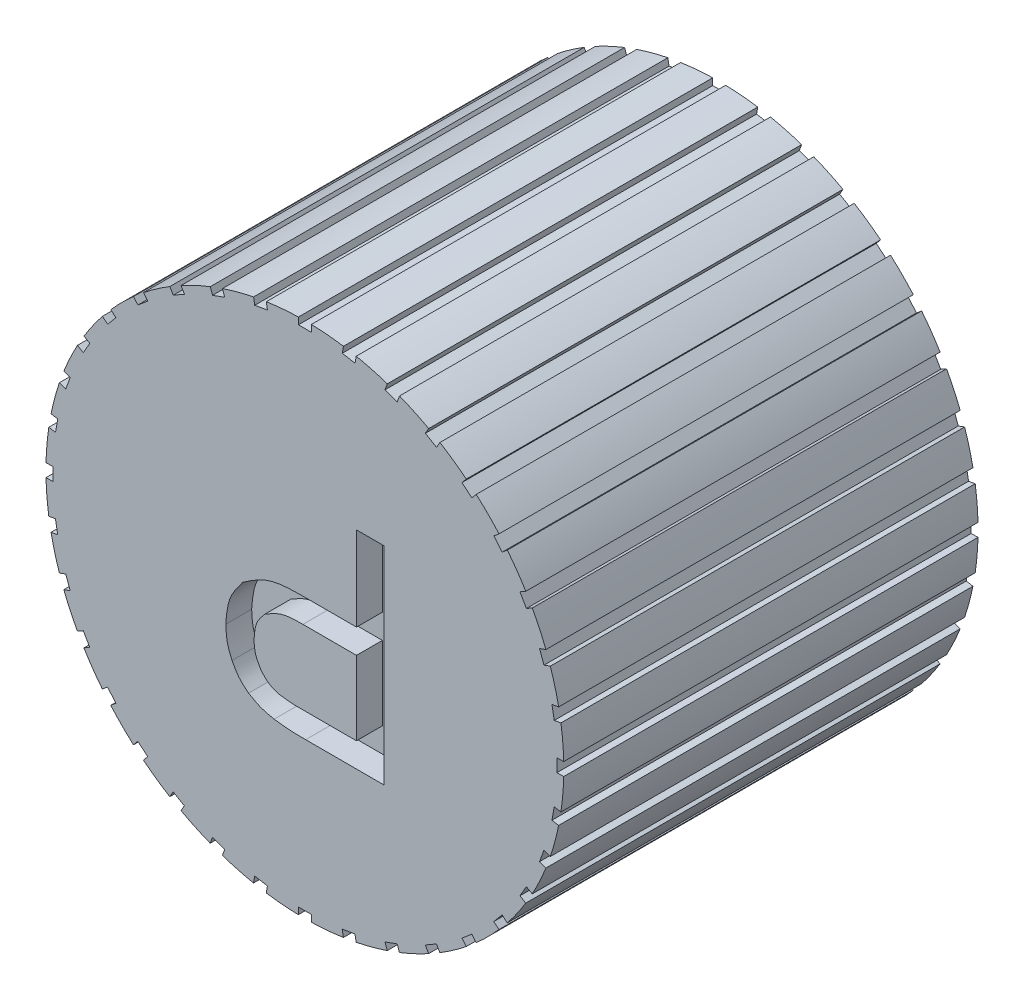
from build123d import *

# Parameters (mm, degrees)
SKETCH1_W                    = 10.000000149
SKETCH1_H                    = 16
CUT_EXTRUDE1_DEPTH           = 16
CUT_EXTRUDE2_DEPTH           = 16
CUT_EXTRUDE3_DEPTH           = 16
CUT_EXTRUDE4_DEPTH           = 16
CUT_EXTRUDE5_DEPTH           = 16
CUT_EXTRUDE6_DEPTH           = 16
CUT_EXTRUDE7_DEPTH           = 16
CUT_EXTRUDE8_DEPTH           = 16
CUT_EXTRUDE9_DEPTH           = 16
CUT_EXTRUDE10_DEPTH          = 16
CUT_EXTRUDE11_DEPTH          = 16
CUT_EXTRUDE12_DEPTH          = 16
CUT_EXTRUDE13_DEPTH          = 16
CUT_EXTRUDE14_DEPTH          = 16
CUT_EXTRUDE15_DEPTH          = 16
CUT_EXTRUDE16_DEPTH          = 16
CUT_EXTRUDE17_DEPTH          = 16
CUT_EXTRUDE18_DEPTH          = 16
CUT_EXTRUDE19_DEPTH          = 16
CUT_EXTRUDE20_DEPTH          = 16
CUT_EXTRUDE21_DEPTH          = 16
CUT_EXTRUDE22_DEPTH          = 16
CUT_EXTRUDE23_DEPTH          = 16
CUT_EXTRUDE24_DEPTH          = 16
CUT_EXTRUDE25_DEPTH          = 16
CUT_EXTRUDE26_DEPTH          = 16
CUT_EXTRUDE27_DEPTH          = 16
CUT_EXTRUDE28_DEPTH          = 16
CUT_EXTRUDE29_DEPTH          = 16
CUT_EXTRUDE30_DEPTH          = 16
CUT_EXTRUDE31_DEPTH          = 16
CUT_EXTRUDE32_DEPTH          = 16
CUT_EXTRUDE33_DEPTH          = 16
CUT_EXTRUDE34_DEPTH          = 16
CUT_EXTRUDE35_DEPTH          = 16
CUT_EXTRUDE36_DEPTH          = 16
CUT_EXTRUDE37_START          = 3
CUT_EXTRUDE37_DEPTH          = 1
BOSS_EXTRUDE1_START          = 2.999997
BOSS_EXTRUDE1_DEPTH          = 1
F_6_0_6_DIAMETER_HOLE1_D     = 6
F_6_0_6_DIAMETER_HOLE1_DEPTH = 14


with BuildPart() as part:
    # Sketch1 → Revolve1 (revolve)
    with BuildSketch(Plane(origin=(0, 0, 0), x_dir=(1, 0, 0), z_dir=(0, 1, 0))):
        with Locations((5.000000074, -8)):
            Rectangle(SKETCH1_W, SKETCH1_H)
    revolve(axis=Axis((0, 0, 0), (0, 0, 1)))

    # Sketch2 → Cut-Extrude1 (cut)
    with BuildSketch(Plane(origin=(0, 0, 0), x_dir=(-1, 0, 0), z_dir=(0, 0, -1))):
        with BuildLine():
            Line((3.182999705, 9.479900625), (3.093633551, 9.234369134))
            Line((3.093633551, 9.234369134), (3.563197034, 9.063462003))
            Line((3.563197034, 9.063462003), (3.65258757, 9.30906048))
            ThreePointArc((3.65258757, 9.30906048), (3.418860912, 9.397414168), (3.182999705, 9.479900625))
        make_face()
    extrude(amount=-CUT_EXTRUDE1_DEPTH, mode=Mode.SUBTRACT)

    # Sketch3 → Cut-Extrude2 (cut)
    with BuildSketch(Plane(origin=(0, 0, 0), x_dir=(-1, 0, 0), z_dir=(0, 0, -1))):
        with BuildLine():
            Line((4.780810256, 8.783157535), (4.650165678, 8.556874488))
            Line((4.650165678, 8.556874488), (5.082917725, 8.307024978))
            Line((5.082917725, 8.307024978), (5.213597945, 8.533369759))
            ThreePointArc((5.213597945, 8.533369759), (4.998764578, 8.660967364), (4.780810256, 8.783157535))
        make_face()
    extrude(amount=-CUT_EXTRUDE2_DEPTH, mode=Mode.SUBTRACT)

    # Sketch4 → Cut-Extrude3 (cut)
    with BuildSketch(Plane(origin=(0, 0, 0), x_dir=(-1, 0, 0), z_dir=(0, 0, -1))):
        with BuildLine():
            Line((6.233358306, 7.819542647), (6.065404874, 7.619383542))
            Line((6.065404874, 7.619383542), (6.448196533, 7.298183202))
            Line((6.448196533, 7.298183202), (6.616195786, 7.498396916))
            ThreePointArc((6.616195786, 7.498396916), (6.426783311, 7.661361449), (6.233358306, 7.819542647))
        make_face()
    extrude(amount=-CUT_EXTRUDE3_DEPTH, mode=Mode.SUBTRACT)

    # Sketch5 → Cut-Extrude4 (cut)
    with BuildSketch(Plane(origin=(0, 0, 0), x_dir=(-1, 0, 0), z_dir=(0, 0, -1))):
        with BuildLine():
            Line((7.496508918, 6.618334914), (7.296349812, 6.450381482))
            Line((7.296349812, 6.450381482), (7.617550152, 6.067589824))
            Line((7.617550152, 6.067589824), (7.817763865, 6.235589077))
            ThreePointArc((7.817763865, 6.235589077), (7.659527486, 6.428968943), (7.496508918, 6.618334914))
        make_face()
    extrude(amount=-CUT_EXTRUDE4_DEPTH, mode=Mode.SUBTRACT)

    # Sketch6 → Cut-Extrude5 (cut)
    with BuildSketch(Plane(origin=(0, 0, 0), x_dir=(-1, 0, 0), z_dir=(0, 0, -1))):
        with BuildLine():
            Line((8.531881899, 5.216032423), (8.305598853, 5.085387845))
            Line((8.305598853, 5.085387845), (8.555448364, 4.652635798))
            Line((8.555448364, 4.652635798), (8.781793145, 4.783316019))
            ThreePointArc((8.781793145, 4.783316019), (8.659540794, 5.001235469), (8.531881899, 5.216032423))
        make_face()
    extrude(amount=-CUT_EXTRUDE5_DEPTH, mode=Mode.SUBTRACT)

    # Sketch7 → Cut-Extrude6 (cut)
    with BuildSketch(Plane(origin=(0, 0, 0), x_dir=(-1, 0, 0), z_dir=(0, 0, -1))):
        with BuildLine():
            Line((9.308017967, 3.655243426), (9.062486476, 3.565877272))
            Line((9.062486476, 3.565877272), (9.233393607, 3.096313789))
            Line((9.233393607, 3.096313789), (9.478992085, 3.185704324))
            ThreePointArc((9.478992085, 3.185704324), (9.396438337, 3.421541987), (9.308017967, 3.655243426))
        make_face()
    extrude(amount=-CUT_EXTRUDE6_DEPTH, mode=Mode.SUBTRACT)

    # Sketch8 → Cut-Extrude7 (cut)
    with BuildSketch(Plane(origin=(0, 0, 0), x_dir=(-1, 0, 0), z_dir=(0, 0, -1))):
        with BuildLine():
            Line((9.801334619, 1.983391707), (9.544015033, 1.938019322))
            Line((9.544015033, 1.938019322), (9.630786858, 1.445911851))
            Line((9.630786858, 1.445911851), (9.888176646, 1.491296615))
            ThreePointArc((9.888176646, 1.491296615), (9.847829855, 1.737886682), (9.801334619, 1.983391707))
        make_face()
    extrude(amount=-CUT_EXTRUDE7_DEPTH, mode=Mode.SUBTRACT)

    # Sketch9 → Cut-Extrude8 (cut)
    with BuildSketch(Plane(origin=(0, 0, 0), x_dir=(-1, 0, 0), z_dir=(0, 0, -1))):
        with BuildLine():
            Line((9.996842678, 0.251275635), (9.735553523, 0.251275635))
            Line((9.735553523, 0.251275635), (9.735553523, -0.248423386))
            Line((9.735553523, -0.248423386), (9.996913964, -0.248423386))
            ThreePointArc((9.996913964, -0.248423386), (10.000000047, 0.00142657), (9.996842678, 0.251275635))
        make_face()
    extrude(amount=-CUT_EXTRUDE8_DEPTH, mode=Mode.SUBTRACT)

    # Sketch10 → Cut-Extrude9 (cut)
    with BuildSketch(Plane(origin=(0, 0, 0), x_dir=(-1, 0, 0), z_dir=(0, 0, -1))):
        with BuildLine():
            Line((9.888601731, -1.48847532), (9.631282146, -1.443102934))
            Line((9.631282146, -1.443102934), (9.544510321, -1.935210405))
            Line((9.544510321, -1.935210405), (9.80190011, -1.980595169))
            ThreePointArc((9.80190011, -1.980595169), (9.848325298, -1.735076888), (9.888601731, -1.48847532))
        make_face()
    extrude(amount=-CUT_EXTRUDE9_DEPTH, mode=Mode.SUBTRACT)

    # Sketch11 → Cut-Extrude10 (cut)
    with BuildSketch(Plane(origin=(0, 0, 0), x_dir=(-1, 0, 0), z_dir=(0, 0, -1))):
        with BuildLine():
            Line((9.479900625, -3.182999705), (9.234369134, -3.093633551))
            Line((9.234369134, -3.093633551), (9.063462003, -3.563197034))
            Line((9.063462003, -3.563197034), (9.30906048, -3.65258757))
            ThreePointArc((9.30906048, -3.65258757), (9.397414168, -3.418860912), (9.479900625, -3.182999705))
        make_face()
    extrude(amount=-CUT_EXTRUDE10_DEPTH, mode=Mode.SUBTRACT)

    # Sketch12 → Cut-Extrude11 (cut)
    with BuildSketch(Plane(origin=(0, 0, 0), x_dir=(-1, 0, 0), z_dir=(0, 0, -1))):
        with BuildLine():
            Line((8.783157535, -4.780810256), (8.556874488, -4.650165678))
            Line((8.556874488, -4.650165678), (8.307024978, -5.082917725))
            Line((8.307024978, -5.082917725), (8.533369759, -5.213597945))
            ThreePointArc((8.533369759, -5.213597945), (8.660967364, -4.998764578), (8.783157535, -4.780810256))
        make_face()
    extrude(amount=-CUT_EXTRUDE11_DEPTH, mode=Mode.SUBTRACT)

    # Sketch13 → Cut-Extrude12 (cut)
    with BuildSketch(Plane(origin=(0, 0, 0), x_dir=(-1, 0, 0), z_dir=(0, 0, -1))):
        with BuildLine():
            Line((7.819542647, -6.233358306), (7.619383542, -6.065404874))
            Line((7.619383542, -6.065404874), (7.298183202, -6.448196533))
            Line((7.298183202, -6.448196533), (7.498396916, -6.616195786))
            ThreePointArc((7.498396916, -6.616195786), (7.661361449, -6.426783311), (7.819542647, -6.233358306))
        make_face()
    extrude(amount=-CUT_EXTRUDE12_DEPTH, mode=Mode.SUBTRACT)

    # Sketch14 → Cut-Extrude13 (cut)
    with BuildSketch(Plane(origin=(0, 0, 0), x_dir=(-1, 0, 0), z_dir=(0, 0, -1))):
        with BuildLine():
            Line((6.618334914, -7.496508918), (6.450381482, -7.296349812))
            Line((6.450381482, -7.296349812), (6.067589824, -7.617550152))
            Line((6.067589824, -7.617550152), (6.235589077, -7.817763865))
            ThreePointArc((6.235589077, -7.817763865), (6.428968943, -7.659527486), (6.618334914, -7.496508918))
        make_face()
    extrude(amount=-CUT_EXTRUDE13_DEPTH, mode=Mode.SUBTRACT)

    # Sketch15 → Cut-Extrude14 (cut)
    with BuildSketch(Plane(origin=(0, 0, 0), x_dir=(-1, 0, 0), z_dir=(0, 0, -1))):
        with BuildLine():
            Line((5.216032423, -8.531881899), (5.085387845, -8.305598853))
            Line((5.085387845, -8.305598853), (4.652635798, -8.555448364))
            Line((4.652635798, -8.555448364), (4.783316019, -8.781793145))
            ThreePointArc((4.783316019, -8.781793145), (5.001235469, -8.659540794), (5.216032423, -8.531881899))
        make_face()
    extrude(amount=-CUT_EXTRUDE14_DEPTH, mode=Mode.SUBTRACT)

    # Sketch16 → Cut-Extrude15 (cut)
    with BuildSketch(Plane(origin=(0, 0, 0), x_dir=(-1, 0, 0), z_dir=(0, 0, -1))):
        with BuildLine():
            Line((3.655243426, -9.308017967), (3.565877272, -9.062486476))
            Line((3.565877272, -9.062486476), (3.096313789, -9.233393607))
            Line((3.096313789, -9.233393607), (3.185704324, -9.478992085))
            ThreePointArc((3.185704324, -9.478992085), (3.421541987, -9.396438337), (3.655243426, -9.308017967))
        make_face()
    extrude(amount=-CUT_EXTRUDE15_DEPTH, mode=Mode.SUBTRACT)

    # Sketch17 → Cut-Extrude16 (cut)
    with BuildSketch(Plane(origin=(0, 0, 0), x_dir=(-1, 0, 0), z_dir=(0, 0, -1))):
        with BuildLine():
            Line((1.983391707, -9.801334619), (1.938019322, -9.544015033))
            Line((1.938019322, -9.544015033), (1.445911851, -9.630786858))
            Line((1.445911851, -9.630786858), (1.491296615, -9.888176646))
            ThreePointArc((1.491296615, -9.888176646), (1.737886682, -9.847829855), (1.983391707, -9.801334619))
        make_face()
    extrude(amount=-CUT_EXTRUDE16_DEPTH, mode=Mode.SUBTRACT)

    # Sketch18 → Cut-Extrude17 (cut)
    with BuildSketch(Plane(origin=(0, 0, 0), x_dir=(-1, 0, 0), z_dir=(0, 0, -1))):
        with BuildLine():
            Line((0.251275635, -9.996842678), (0.251275635, -9.735553523))
            Line((0.251275635, -9.735553523), (-0.248423386, -9.735553523))
            Line((-0.248423386, -9.735553523), (-0.248423386, -9.996913964))
            ThreePointArc((-0.248423386, -9.996913964), (0.00142657, -10.000000047), (0.251275635, -9.996842678))
        make_face()
    extrude(amount=-CUT_EXTRUDE17_DEPTH, mode=Mode.SUBTRACT)

    # Sketch19 → Cut-Extrude18 (cut)
    with BuildSketch(Plane(origin=(0, 0, 0), x_dir=(-1, 0, 0), z_dir=(0, 0, -1))):
        with BuildLine():
            Line((-1.48847532, -9.888601731), (-1.443102934, -9.631282146))
            Line((-1.443102934, -9.631282146), (-1.935210405, -9.544510321))
            Line((-1.935210405, -9.544510321), (-1.980595169, -9.80190011))
            ThreePointArc((-1.980595169, -9.80190011), (-1.735076888, -9.848325298), (-1.48847532, -9.888601731))
        make_face()
    extrude(amount=-CUT_EXTRUDE18_DEPTH, mode=Mode.SUBTRACT)

    # Sketch20 → Cut-Extrude19 (cut)
    with BuildSketch(Plane(origin=(0, 0, 0), x_dir=(-1, 0, 0), z_dir=(0, 0, -1))):
        with BuildLine():
            Line((-3.182999705, -9.479900625), (-3.093633551, -9.234369134))
            Line((-3.093633551, -9.234369134), (-3.563197034, -9.063462003))
            Line((-3.563197034, -9.063462003), (-3.65258757, -9.30906048))
            ThreePointArc((-3.65258757, -9.30906048), (-3.418860912, -9.397414168), (-3.182999705, -9.479900625))
        make_face()
    extrude(amount=-CUT_EXTRUDE19_DEPTH, mode=Mode.SUBTRACT)

    # Sketch21 → Cut-Extrude20 (cut)
    with BuildSketch(Plane(origin=(0, 0, 0), x_dir=(-1, 0, 0), z_dir=(0, 0, -1))):
        with BuildLine():
            Line((-4.780810256, -8.783157535), (-4.650165678, -8.556874488))
            Line((-4.650165678, -8.556874488), (-5.082917725, -8.307024978))
            Line((-5.082917725, -8.307024978), (-5.213597945, -8.533369759))
            ThreePointArc((-5.213597945, -8.533369759), (-4.998764578, -8.660967364), (-4.780810256, -8.783157535))
        make_face()
    extrude(amount=-CUT_EXTRUDE20_DEPTH, mode=Mode.SUBTRACT)

    # Sketch22 → Cut-Extrude21 (cut)
    with BuildSketch(Plane(origin=(0, 0, 0), x_dir=(-1, 0, 0), z_dir=(0, 0, -1))):
        with BuildLine():
            Line((-6.233358306, -7.819542647), (-6.065404874, -7.619383542))
            Line((-6.065404874, -7.619383542), (-6.448196533, -7.298183202))
            Line((-6.448196533, -7.298183202), (-6.616195786, -7.498396916))
            ThreePointArc((-6.616195786, -7.498396916), (-6.426783311, -7.661361449), (-6.233358306, -7.819542647))
        make_face()
    extrude(amount=-CUT_EXTRUDE21_DEPTH, mode=Mode.SUBTRACT)

    # Sketch23 → Cut-Extrude22 (cut)
    with BuildSketch(Plane(origin=(0, 0, 0), x_dir=(-1, 0, 0), z_dir=(0, 0, -1))):
        with BuildLine():
            Line((-7.496508918, -6.618334914), (-7.296349812, -6.450381482))
            Line((-7.296349812, -6.450381482), (-7.617550152, -6.067589824))
            Line((-7.617550152, -6.067589824), (-7.817763865, -6.235589077))
            ThreePointArc((-7.817763865, -6.235589077), (-7.659527486, -6.428968943), (-7.496508918, -6.618334914))
        make_face()
    extrude(amount=-CUT_EXTRUDE22_DEPTH, mode=Mode.SUBTRACT)

    # Sketch24 → Cut-Extrude23 (cut)
    with BuildSketch(Plane(origin=(0, 0, 0), x_dir=(-1, 0, 0), z_dir=(0, 0, -1))):
        with BuildLine():
            Line((-8.531881899, -5.216032423), (-8.305598853, -5.085387845))
            Line((-8.305598853, -5.085387845), (-8.555448364, -4.652635798))
            Line((-8.555448364, -4.652635798), (-8.781793145, -4.783316019))
            ThreePointArc((-8.781793145, -4.783316019), (-8.659540794, -5.001235469), (-8.531881899, -5.216032423))
        make_face()
    extrude(amount=-CUT_EXTRUDE23_DEPTH, mode=Mode.SUBTRACT)

    # Sketch25 → Cut-Extrude24 (cut)
    with BuildSketch(Plane(origin=(0, 0, 0), x_dir=(-1, 0, 0), z_dir=(0, 0, -1))):
        with BuildLine():
            Line((-9.308017967, -3.655243426), (-9.062486476, -3.565877272))
            Line((-9.062486476, -3.565877272), (-9.233393607, -3.096313789))
            Line((-9.233393607, -3.096313789), (-9.478992085, -3.185704324))
            ThreePointArc((-9.478992085, -3.185704324), (-9.396438337, -3.421541987), (-9.308017967, -3.655243426))
        make_face()
    extrude(amount=-CUT_EXTRUDE24_DEPTH, mode=Mode.SUBTRACT)

    # Sketch26 → Cut-Extrude25 (cut)
    with BuildSketch(Plane(origin=(0, 0, 0), x_dir=(-1, 0, 0), z_dir=(0, 0, -1))):
        with BuildLine():
            Line((-9.801334619, -1.983391707), (-9.544015033, -1.938019322))
            Line((-9.544015033, -1.938019322), (-9.630786858, -1.445911851))
            Line((-9.630786858, -1.445911851), (-9.888176646, -1.491296615))
            ThreePointArc((-9.888176646, -1.491296615), (-9.847829855, -1.737886682), (-9.801334619, -1.983391707))
        make_face()
    extrude(amount=-CUT_EXTRUDE25_DEPTH, mode=Mode.SUBTRACT)

    # Sketch27 → Cut-Extrude26 (cut)
    with BuildSketch(Plane(origin=(0, 0, 0), x_dir=(-1, 0, 0), z_dir=(0, 0, -1))):
        with BuildLine():
            Line((-9.996842678, -0.251275635), (-9.735553523, -0.251275635))
            Line((-9.735553523, -0.251275635), (-9.735553523, 0.248423386))
            Line((-9.735553523, 0.248423386), (-9.996913964, 0.248423386))
            ThreePointArc((-9.996913964, 0.248423386), (-10.000000047, -0.00142657), (-9.996842678, -0.251275635))
        make_face()
    extrude(amount=-CUT_EXTRUDE26_DEPTH, mode=Mode.SUBTRACT)

    # Sketch28 → Cut-Extrude27 (cut)
    with BuildSketch(Plane(origin=(0, 0, 0), x_dir=(-1, 0, 0), z_dir=(0, 0, -1))):
        with BuildLine():
            Line((-9.888601731, 1.48847532), (-9.631282146, 1.443102934))
            Line((-9.631282146, 1.443102934), (-9.544510321, 1.935210405))
            Line((-9.544510321, 1.935210405), (-9.80190011, 1.980595169))
            ThreePointArc((-9.80190011, 1.980595169), (-9.848325298, 1.735076888), (-9.888601731, 1.48847532))
        make_face()
    extrude(amount=-CUT_EXTRUDE27_DEPTH, mode=Mode.SUBTRACT)

    # Sketch29 → Cut-Extrude28 (cut)
    with BuildSketch(Plane(origin=(0, 0, 0), x_dir=(-1, 0, 0), z_dir=(0, 0, -1))):
        with BuildLine():
            Line((-9.479900625, 3.182999705), (-9.234369134, 3.093633551))
            Line((-9.234369134, 3.093633551), (-9.063462003, 3.563197034))
            Line((-9.063462003, 3.563197034), (-9.30906048, 3.65258757))
            ThreePointArc((-9.30906048, 3.65258757), (-9.397414168, 3.418860912), (-9.479900625, 3.182999705))
        make_face()
    extrude(amount=-CUT_EXTRUDE28_DEPTH, mode=Mode.SUBTRACT)

    # Sketch30 → Cut-Extrude29 (cut)
    with BuildSketch(Plane(origin=(0, 0, 0), x_dir=(-1, 0, 0), z_dir=(0, 0, -1))):
        with BuildLine():
            Line((-8.783157535, 4.780810256), (-8.556874488, 4.650165678))
            Line((-8.556874488, 4.650165678), (-8.307024978, 5.082917725))
            Line((-8.307024978, 5.082917725), (-8.533369759, 5.213597945))
            ThreePointArc((-8.533369759, 5.213597945), (-8.660967364, 4.998764578), (-8.783157535, 4.780810256))
        make_face()
    extrude(amount=-CUT_EXTRUDE29_DEPTH, mode=Mode.SUBTRACT)

    # Sketch31 → Cut-Extrude30 (cut)
    with BuildSketch(Plane(origin=(0, 0, 0), x_dir=(-1, 0, 0), z_dir=(0, 0, -1))):
        with BuildLine():
            Line((-7.819542647, 6.233358306), (-7.619383542, 6.065404874))
            Line((-7.619383542, 6.065404874), (-7.298183202, 6.448196533))
            Line((-7.298183202, 6.448196533), (-7.498396916, 6.616195786))
            ThreePointArc((-7.498396916, 6.616195786), (-7.661361449, 6.426783311), (-7.819542647, 6.233358306))
        make_face()
    extrude(amount=-CUT_EXTRUDE30_DEPTH, mode=Mode.SUBTRACT)

    # Sketch32 → Cut-Extrude31 (cut)
    with BuildSketch(Plane(origin=(0, 0, 0), x_dir=(-1, 0, 0), z_dir=(0, 0, -1))):
        with BuildLine():
            Line((-6.618334914, 7.496508918), (-6.450381482, 7.296349812))
            Line((-6.450381482, 7.296349812), (-6.067589824, 7.617550152))
            Line((-6.067589824, 7.617550152), (-6.235589077, 7.817763865))
            ThreePointArc((-6.235589077, 7.817763865), (-6.428968943, 7.659527486), (-6.618334914, 7.496508918))
        make_face()
    extrude(amount=-CUT_EXTRUDE31_DEPTH, mode=Mode.SUBTRACT)

    # Sketch33 → Cut-Extrude32 (cut)
    with BuildSketch(Plane(origin=(0, 0, 0), x_dir=(-1, 0, 0), z_dir=(0, 0, -1))):
        with BuildLine():
            Line((-5.216032423, 8.531881899), (-5.085387845, 8.305598853))
            Line((-5.085387845, 8.305598853), (-4.652635798, 8.555448364))
            Line((-4.652635798, 8.555448364), (-4.783316019, 8.781793145))
            ThreePointArc((-4.783316019, 8.781793145), (-5.001235469, 8.659540794), (-5.216032423, 8.531881899))
        make_face()
    extrude(amount=-CUT_EXTRUDE32_DEPTH, mode=Mode.SUBTRACT)

    # Sketch34 → Cut-Extrude33 (cut)
    with BuildSketch(Plane(origin=(0, 0, 0), x_dir=(-1, 0, 0), z_dir=(0, 0, -1))):
        with BuildLine():
            Line((-3.655243426, 9.308017967), (-3.565877272, 9.062486476))
            Line((-3.565877272, 9.062486476), (-3.096313789, 9.233393607))
            Line((-3.096313789, 9.233393607), (-3.185704324, 9.478992085))
            ThreePointArc((-3.185704324, 9.478992085), (-3.421541987, 9.396438337), (-3.655243426, 9.308017967))
        make_face()
    extrude(amount=-CUT_EXTRUDE33_DEPTH, mode=Mode.SUBTRACT)

    # Sketch35 → Cut-Extrude34 (cut)
    with BuildSketch(Plane(origin=(0, 0, 0), x_dir=(-1, 0, 0), z_dir=(0, 0, -1))):
        with BuildLine():
            Line((-1.983391707, 9.801334619), (-1.938019322, 9.544015033))
            Line((-1.938019322, 9.544015033), (-1.445911851, 9.630786858))
            Line((-1.445911851, 9.630786858), (-1.491296615, 9.888176646))
            ThreePointArc((-1.491296615, 9.888176646), (-1.737886682, 9.847829855), (-1.983391707, 9.801334619))
        make_face()
    extrude(amount=-CUT_EXTRUDE34_DEPTH, mode=Mode.SUBTRACT)

    # Sketch36 → Cut-Extrude35 (cut)
    with BuildSketch(Plane(origin=(0, 0, 0), x_dir=(-1, 0, 0), z_dir=(0, 0, -1))):
        with BuildLine():
            Line((-0.251275635, 9.996842678), (-0.251275635, 9.735553523))
            Line((-0.251275635, 9.735553523), (0.248423386, 9.735553523))
            Line((0.248423386, 9.735553523), (0.248423386, 9.996913964))
            ThreePointArc((0.248423386, 9.996913964), (-0.00142657, 10.000000047), (-0.251275635, 9.996842678))
        make_face()
    extrude(amount=-CUT_EXTRUDE35_DEPTH, mode=Mode.SUBTRACT)

    # Sketch37 → Cut-Extrude36 (cut)
    with BuildSketch(Plane(origin=(0, 0, 0), x_dir=(-1, 0, 0), z_dir=(0, 0, -1))):
        with BuildLine():
            Line((1.48847532, 9.888601731), (1.443102934, 9.631282146))
            Line((1.443102934, 9.631282146), (1.935210405, 9.544510321))
            Line((1.935210405, 9.544510321), (1.980595169, 9.80190011))
            ThreePointArc((1.980595169, 9.80190011), (1.735076888, 9.848325298), (1.48847532, 9.888601731))
        make_face()
    extrude(amount=-CUT_EXTRUDE36_DEPTH, mode=Mode.SUBTRACT)

    # Sketch38 → Cut-Extrude37 (cut)
    with BuildSketch(Plane.XY.offset(13.000000423).offset(CUT_EXTRUDE37_START)):
        with BuildLine():
            Line((3.049615724, -4.002738564), (0.031881756, -4.000030609))
            ThreePointArc((0.031881756, -4.000030609), (-0.578157383, -3.986647997), (-1.184966236, -3.922539794))
            add(Edge.make_bspline(
                [(-1.184966236, -3.922539794), (-1.223529597, -3.914692021), (-1.300632682, -3.899001287), (-1.415905397, -3.873776209), (-1.530354203, -3.845005566), (-1.643508949, -3.810954195), (-1.754400929, -3.769705293), (-1.8621045, -3.720524251), (-1.967127766, -3.66594584), (-2.07023791, -3.607762106), (-2.138313422, -3.567819627), (-2.172352087, -3.547847854)],
                knots=[0, 0, 0, 0, 0.110985551, 0.221903076, 0.332758481, 0.443718508, 0.554995302, 0.666142445, 0.777406375, 0.888700216, 1, 1, 1, 1], degree=3))
            add(Edge.make_bspline(
                [(-2.172352087, -3.547847854), (-2.201399361, -3.524190475), (-2.25946519, -3.476899109), (-2.345185972, -3.404359487), (-2.428020776, -3.328525248), (-2.50650315, -3.247820578), (-2.578160886, -3.160689486), (-2.642938983, -3.068161888), (-2.702519598, -2.972236553), (-2.758554302, -2.874154775), (-2.794757381, -2.808121291), (-2.812859467, -2.775103553)],
                knots=[0, 0, 0, 0, 0.110867075, 0.221624533, 0.332283333, 0.443111925, 0.554485279, 0.665740791, 0.777134787, 0.88856403, 1, 1, 1, 1], degree=3))
            add(Edge.make_bspline(
                [(-2.812859467, -2.775103553), (-2.841443586, -2.705756514), (-2.89857619, -2.567148884), (-2.973321896, -2.354526041), (-3.021750517, -2.133875749), (-3.0440039, -1.909049049), (-3.051144311, -1.758714537), (-3.054717668, -1.68348093)],
                knots=[0, 0, 0, 0, 0.199722269, 0.39919556, 0.599257577, 0.799451917, 1, 1, 1, 1], degree=3))
            add(Edge.make_bspline(
                [(-3.054717668, -1.68348093), (-3.047737797, -1.593537953), (-3.033798225, -1.413911897), (-3.001469138, -1.146387095), (-2.945828844, -0.883413737), (-2.851863222, -0.630881582), (-2.71979662, -0.39550696), (-2.566679279, -0.172654132), (-2.458092011, -0.02884331), (-2.403781433, 0.04308454)],
                knots=[0, 0, 0, 0, 0.143507385, 0.286600092, 0.428441593, 0.570097682, 0.713347845, 0.856629194, 1, 1, 1, 1], degree=3))
            add(Edge.make_bspline(
                [(-2.403781433, 0.04308454), (-2.326902174, 0.096523361), (-2.17320633, 0.203357438), (-1.93735723, 0.356122761), (-1.691760512, 0.491342053), (-1.43430261, 0.598870512), (-1.166214278, 0.670075238), (-0.892359312, 0.712698301), (-0.614978763, 0.735240624), (-0.335948212, 0.744667932), (-0.149737532, 0.74666514), (-0.056627216, 0.747663798)],
                knots=[0, 0, 0, 0, 0.111905068, 0.223718908, 0.335717424, 0.44657189, 0.556278919, 0.666368667, 0.777426088, 0.888707098, 1, 1, 1, 1], degree=3))
            Line((-0.056627216, 0.747663798), (1.995213574, 0.745822584))
            Line((1.995213574, 0.745822584), (1.998132094, 3.998208322))
            Line((1.998132094, 3.998208322), (3.056794499, 3.997258334))
            Line((3.056794499, 3.997258334), (3.049615724, -4.002738564))
        make_face()
    extrude(amount=-CUT_EXTRUDE37_DEPTH, mode=Mode.SUBTRACT)

    # Sketch39 → Boss-Extrude1 (add)
    with BuildSketch(Plane.YX.offset(-17.999997077).offset(BOSS_EXTRUDE1_START)):
        with BuildLine():
            Line((-3.055887188, -0.054583515), (-3.057723505, 1.991800473))
            Line((-3.057723505, 1.991800473), (-0.198243083, 1.994366419))
            Line((-0.198243083, 1.994366419), (-0.196387179, -0.073845376))
            add(Edge.make_bspline(
                [(-0.196387179, -0.073845376), (-0.196961826, -0.130813627), (-0.198111069, -0.244745217), (-0.203282623, -0.415486361), (-0.215766383, -0.585312763), (-0.239221284, -0.753177067), (-0.2777468, -0.917914932), (-0.335369174, -1.077734126), (-0.407862477, -1.232449717), (-0.490290292, -1.382995711), (-0.548142554, -1.48180489), (-0.57707143, -1.53121417)],
                knots=[0, 0, 0, 0, 0.111440729, 0.222871851, 0.334089567, 0.444372438, 0.554108953, 0.664377463, 0.776028208, 0.888003474, 1, 1, 1, 1], degree=3))
            add(Edge.make_bspline(
                [(-0.57707143, -1.53121417), (-0.610564936, -1.560137242), (-0.677533231, -1.617967223), (-0.780670328, -1.701629926), (-0.88879894, -1.778254492), (-1.003874926, -1.843611735), (-1.127412603, -1.891453939), (-1.256212327, -1.922653341), (-1.387444597, -1.942385603), (-1.519434709, -1.954640317), (-1.607607048, -1.960401421), (-1.651717692, -1.963283573)],
                knots=[0, 0, 0, 0, 0.111393814, 0.222725375, 0.334165361, 0.444661258, 0.554940799, 0.666419564, 0.777581417, 0.88872897, 1, 1, 1, 1], degree=3))
            add(Edge.make_bspline(
                [(-1.651717692, -1.963283573), (-1.685472689, -1.961418723), (-1.752979544, -1.957689198), (-1.854055266, -1.949965454), (-1.954400619, -1.937868345), (-2.053336817, -1.919268895), (-2.149925944, -1.891529606), (-2.243430105, -1.853982969), (-2.334411852, -1.809716283), (-2.423475425, -1.76103467), (-2.482108274, -1.727214379), (-2.511426742, -1.710303054)],
                knots=[0, 0, 0, 0, 0.111518595, 0.223026817, 0.334339662, 0.444774169, 0.554757954, 0.665246197, 0.776716088, 0.888350262, 1, 1, 1, 1], degree=3))
            add(Edge.make_bspline(
                [(-2.511426742, -1.710303054), (-2.535207742, -1.6904939), (-2.582766685, -1.65087814), (-2.652638599, -1.5897891), (-2.719174863, -1.525478231), (-2.780470241, -1.45655213), (-2.833892634, -1.381343104), (-2.878801987, -1.300405311), (-2.917461415, -1.215933103), (-2.951811278, -1.129472004), (-2.973308332, -1.071322747), (-2.984059439, -1.04224114)],
                knots=[0, 0, 0, 0, 0.111394055, 0.222773785, 0.333964464, 0.444244811, 0.554264408, 0.665234817, 0.776871684, 0.888409062, 1, 1, 1, 1], degree=3))
            ThreePointArc((-2.984059439, -1.04224114), (-3.046703381, -0.550356281), (-3.055887188, -0.054583515))
        make_face()
    extrude(amount=-BOSS_EXTRUDE1_DEPTH)

    # Ø6.0 (6) Diameter Hole1
    with Locations(Plane(origin=(0, 0, 0), x_dir=(-1, 0, 0), z_dir=(0, 0, -1))):
        with Locations((0, 0)):
            Hole(F_6_0_6_DIAMETER_HOLE1_D / 2, depth=F_6_0_6_DIAMETER_HOLE1_DEPTH)


solid = part.part
